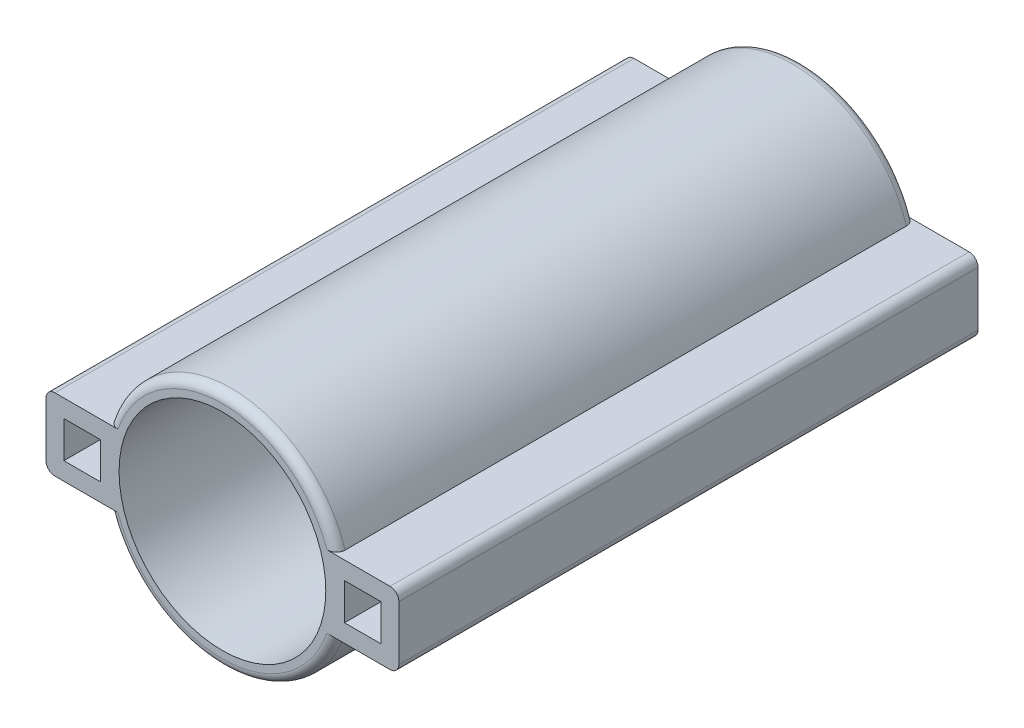
from build123d import *

# Parameters (mm, degrees)
SKETCH1_R           = 67
SKETCH1_R_2         = 58
SKETCH1_W           = 40.5
SKETCH1_H           = 40.5
BOSS_EXTRUDE6_DEPTH = 325
FILLET4_R           = 5


with BuildPart() as part:
    # Sketch1 → Boss-Extrude6 (new body)
    # profile 1 of 3: a face of its own
    with BuildSketch(Plane.XY):
        Circle(SKETCH1_R)
        Circle(SKETCH1_R_2, mode=Mode.SUBTRACT)
    # profile 2 of 3: a face of its own
    with BuildSketch(Plane.XY):
        with Locations((-78.75, 0)):
            Rectangle(SKETCH1_W, SKETCH1_H)
        Polygon((-68.5, -1.08327383), (-68.5, 10.25), (-89, 10.25), (-89, -10.25), (-68.5, -10.25), align=None, mode=Mode.SUBTRACT)
    # profile 3 of 3: a face of its own
    with BuildSketch(Plane.XY):
        with Locations((78.75, 0)):
            Rectangle(SKETCH1_W, SKETCH1_H)
        Polygon((68.5, 10.25), (89, 10.25), (89, -10.25), (68.5, -10.25), (68.5, -1.08327383), align=None, mode=Mode.SUBTRACT)
    extrude(amount=BOSS_EXTRUDE6_DEPTH)

    # Fillet4
    fillet4_edges = [part.edges().sort_by_distance(p)[0] for p in [
        (0, -67, 0),
        (0, -67, 325),
        (0, 67, 0),
        (99, 20.25, 162.5),
        (99, -20.25, 162.5),
        (-99, -20.25, 162.5),
        (-99, 20.25, 162.5),
        (0, 67, 325),
    ]]
    fillet(fillet4_edges, radius=FILLET4_R)


solid = part.part
